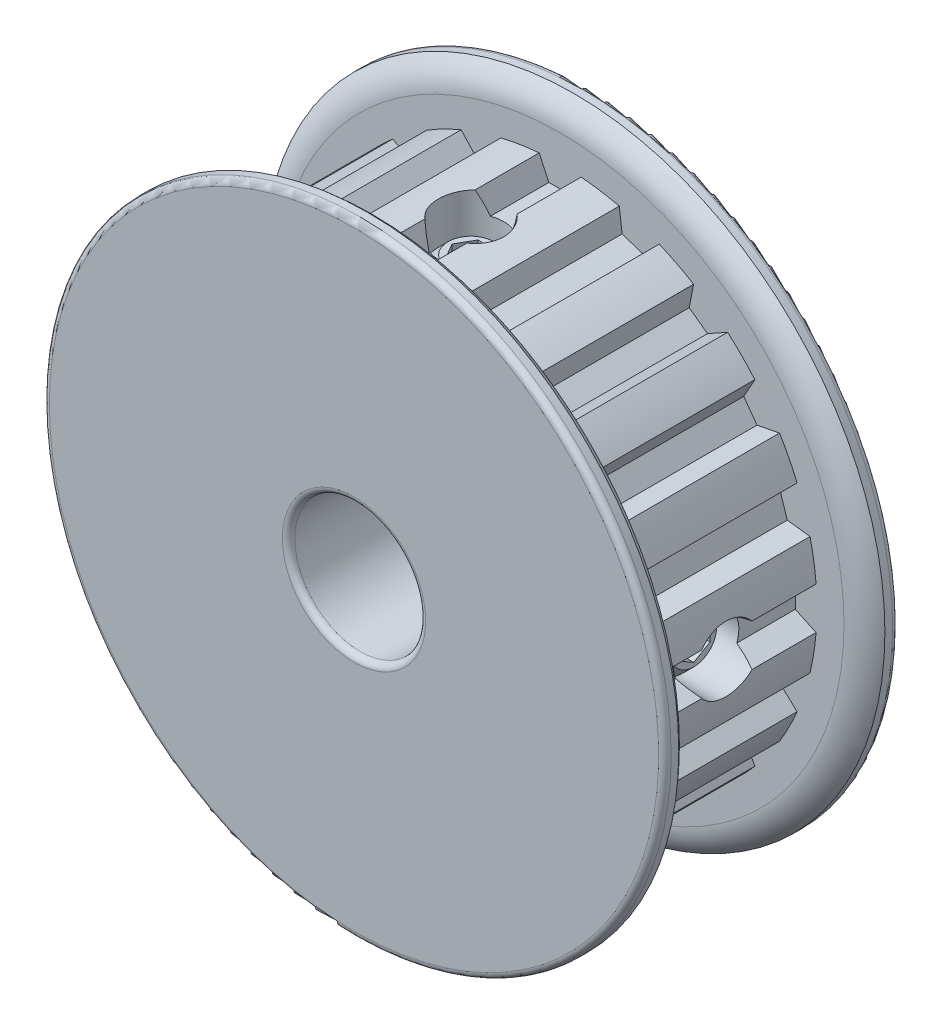
from build123d import *

# Parameters (mm, degrees)
CUT_EXTRUDE1_START = 5.45
CUT_EXTRUDE1_DEPTH = 10.9
CIRPATTERN1_COUNT  = 20
FILLET1_R          = 0.381
SKETCH5_R          = 2
CUT_EXTRUDE2_DEPTH = 28.805080539
CUT_EXTRUDE3_DEPTH = 1
CIRPATTERN2_COUNT  = 2
CIRPATTERN2_ANGLE  = 270


with BuildPart() as part:
    # Sketch2 → Revolve1 (revolve)
    with BuildSketch(Plane(origin=(0, 0, 0), x_dir=(0, 0, -1), z_dir=(1, 0, 0)), mode=Mode.PRIVATE) as revolve1_sk:
        with BuildLine():
            Line((-7.15, 4), (7.15, 4))
            Line((7.15, 4), (7.15, 19))
            Line((7.15, 19), (6.3, 19))
            ThreePointArc((6.3, 19), (5.674952897, 18.276509467), (5.45, 17.347252438))
            Line((5.45, 17.347252438), (5.45, 15.694504876))
            Line((5.45, 15.694504876), (-5.45, 15.694504876))
            Line((-5.45, 15.694504876), (-5.45, 17.347252438))
            ThreePointArc((-5.45, 17.347252438), (-5.674952897, 18.276509467), (-6.3, 19))
            Line((-6.3, 19), (-7.15, 19))
            Line((-7.15, 19), (-7.15, 4))
        make_face()
    revolve(revolve1_sk.sketch.rotate(Axis((0, 0, 7.15), (0, 0, -1)), 90), axis=Axis((0, 0, 7.15), (0, 0, -1)))

    # Sketch3 → Cut-Extrude1 (cut)
    with BuildSketch(Plane.XY.offset(CUT_EXTRUDE1_START)):
        with BuildLine():
            Line((-0.690489274, 14.372), (0.690489274, 14.372))
            Line((0.690489274, 14.372), (1.2827, 15.642))
            ThreePointArc((1.2827, 15.642), (0, 15.694504876), (-1.2827, 15.642))
            Line((-1.2827, 15.642), (-0.690489274, 14.372))
        make_face()
    cut_extrude1 = extrude(amount=-CUT_EXTRUDE1_DEPTH, mode=Mode.SUBTRACT)

    # CirPattern1: Cut-Extrude1 ×20 about axis
    cirpattern1_axis = Axis((0, 0, 0), (0, 0, 1))
    for i in range(1, CIRPATTERN1_COUNT):
        add(cut_extrude1.rotate(cirpattern1_axis, i * 360 / CIRPATTERN1_COUNT), mode=Mode.SUBTRACT)

    # Fillet1
    fillet1_edges = [part.edges().sort_by_distance(p)[0] for p in [
        (-19, 0, -7.15),
        (-4, 0, -7.15),
        (-4, 0, 7.15),
        (-19, 0, 7.15),
    ]]
    fillet(fillet1_edges, radius=FILLET1_R)

    # Sketch5 → Cut-Extrude2 (cut, through all)
    with BuildSketch(Plane(origin=(0, 0, 0), x_dir=(1, 0, 0), z_dir=(0, 1, 0))):
        with Locations(Location((0, 0, 0), (0, 0, 90))):
            Circle(SKETCH5_R)
    cut_extrude2 = extrude(amount=CUT_EXTRUDE2_DEPTH, mode=Mode.SUBTRACT)

    # Sketch6 → Revolve2 (revolve)
    with BuildSketch(Plane(origin=(0, 0, 0), x_dir=(0, 0, -1), z_dir=(1, 0, 0)), mode=Mode.PRIVATE) as revolve2_sk:
        Polygon((0, 13.61), (0, 4.762), (-1.4, 4.762), (-2, 5.362), (-2, 13.01), (-1.4, 13.61), align=None)
    revolve2 = revolve(revolve2_sk.sketch.rotate(Axis((0, 13.61, 0), (0, -1, 0)), 180), axis=Axis((0, 13.61, 0), (0, -1, 0)))

    # Sketch7 → Cut-Extrude3 (cut)
    with BuildSketch(Plane(origin=(0, 13.61, 0), x_dir=(1, 0, 0), z_dir=(0, 1, 0))):
        Polygon((1.154700538, 0), (0.577350269, 1), (-0.577350269, 1), (-1.154700538, 0), (-0.577350269, -1), (0.577350269, -1), align=None)
    cut_extrude3 = extrude(amount=-CUT_EXTRUDE3_DEPTH, mode=Mode.SUBTRACT)

    # CirPattern2: Cut-Extrude2, Revolve2, Cut-Extrude3 ×2 about axis
    cirpattern2_axis = Axis((0, 0, 0), (0, 0, 1))
    add([cut_extrude2.rotate(cirpattern2_axis, i * CIRPATTERN2_ANGLE / (CIRPATTERN2_COUNT - 1)) for i in range(1, CIRPATTERN2_COUNT)], mode=Mode.SUBTRACT)
    add([revolve2.rotate(cirpattern2_axis, i * CIRPATTERN2_ANGLE / (CIRPATTERN2_COUNT - 1)) for i in range(1, CIRPATTERN2_COUNT)])
    add([cut_extrude3.rotate(cirpattern2_axis, i * CIRPATTERN2_ANGLE / (CIRPATTERN2_COUNT - 1)) for i in range(1, CIRPATTERN2_COUNT)], mode=Mode.SUBTRACT)


solid = part.part
